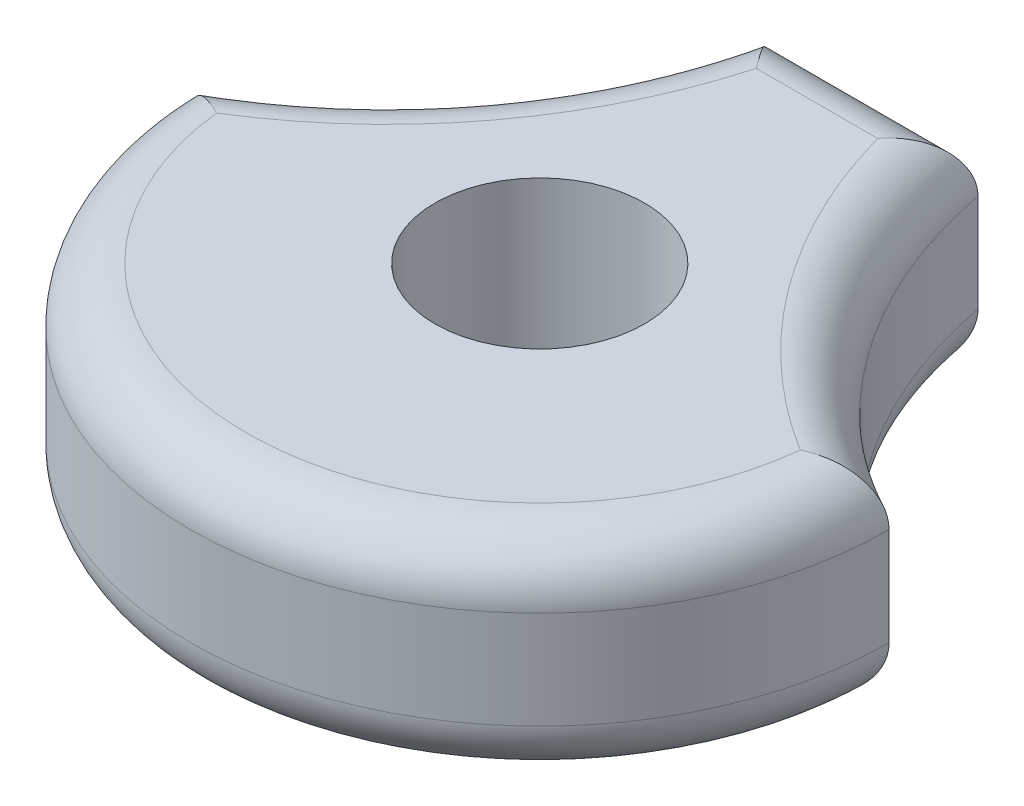
from build123d import *

# Parameters (mm, degrees)
BOSS_EXTRUDE1_DEPTH = 0.375
SKETCH2_R           = 0.1875
CUT_EXTRUDE1_DEPTH  = 0.375
FILLET2_R           = 0.1
SKETCH4_R           = 0.0935
CUT_EXTRUDE2_DEPTH  = 0.187


with BuildPart() as part:
    # Sketch1 → Boss-Extrude1 (new body)
    with BuildSketch(Plane(origin=(0, 0, 0), x_dir=(1, 0, 0), z_dir=(0, 1, 0))):
        with BuildLine():
            Line((-0.188, 0.596054528), (0.188, 0.596054528))
            ThreePointArc((0.188, 0.596054528), (0.338325176, 0.248044592), (0.625, 0))
            ThreePointArc((0.625, 0), (0, -0.625), (-0.625, 0))
            ThreePointArc((-0.625, 0), (-0.338325176, 0.248044592), (-0.188, 0.596054528))
        make_face()
    extrude(amount=BOSS_EXTRUDE1_DEPTH)

    # Sketch2 → Cut-Extrude1 (cut)
    with BuildSketch(Plane(origin=(0, 0.375, 0), x_dir=(1, 0, 0), z_dir=(0, 1, 0))):
        with Locations(Location((0, 0, 0), (0, 0, 270))):
            Circle(SKETCH2_R)
    extrude(amount=-CUT_EXTRUDE1_DEPTH, mode=Mode.SUBTRACT)

    # Fillet2
    fillet2_edges = [part.edges().sort_by_distance(p)[0] for p in [
        (0, 0, -0.596054528),
        (0, 0.375, -0.596054528),
        (-0.338325176, 0, -0.248044592),
        (-0.338325176, 0.375, -0.248044592),
        (0.338325176, 0, -0.248044592),
        (0.338325176, 0.375, -0.248044592),
        (0, 0, 0.625),
        (0, 0.375, 0.625),
    ]]
    fillet(fillet2_edges, radius=FILLET2_R)

    # Sketch4 → Cut-Extrude2 (cut)
    with BuildSketch(Plane.XZ):
        with Locations(Location((0, -0.375, 0), (0, 0, 270))):
            Circle(SKETCH4_R)
    extrude(amount=-CUT_EXTRUDE2_DEPTH, mode=Mode.SUBTRACT)


solid = part.part
